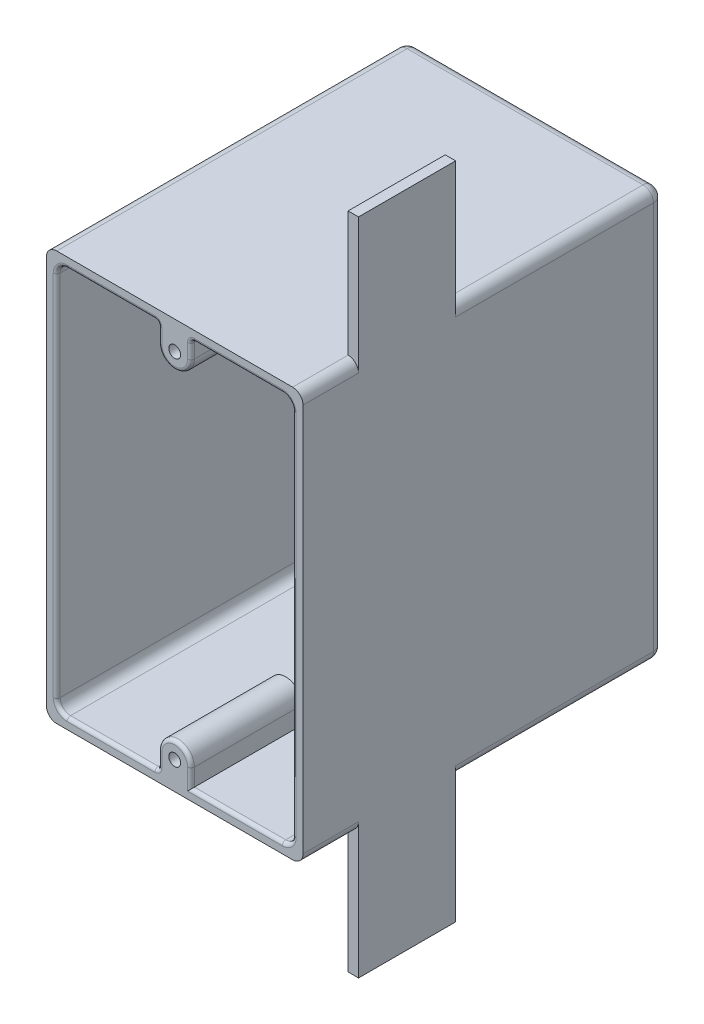
from build123d import *

# Parameters (mm, degrees)
SKETCH1_W           = 58.7375
SKETCH1_H           = 93.6625
BACK_DEPTH          = 2.38125
SKETCH2_W           = 58.7375
SKETCH2_H           = 93.6625
SKETCH2_W_2         = 53.975
SKETCH2_H_2         = 88.9
SIDES_DEPTH         = 80.16875
SKETCH6_R           = 1.35255
BOSS_EXTRUDE6_DEPTH = 25.4
SKETCH5_W           = 22.225
SKETCH5_H           = 28.575
BOSS_EXTRUDE5_DEPTH = 2.38125
FILLET4_R           = 2.38125
FILLET5_R           = 0.79375


with BuildPart() as part:
    # Sketch1 → Back (new body)
    with BuildSketch(Plane.XY):
        Rectangle(SKETCH1_W, SKETCH1_H)
    extrude(amount=BACK_DEPTH)

    # Sketch2 → Sides (add)
    with BuildSketch(Plane.XY.offset(2.38125)):
        Rectangle(SKETCH2_W, SKETCH2_H)
        Rectangle(SKETCH2_W_2, SKETCH2_H_2, mode=Mode.SUBTRACT)
    extrude(amount=SIDES_DEPTH)

    # Sketch6 → Boss-Extrude6 (add)
    # profile 1 of 2: a face of its own
    with BuildSketch(Plane.XY.offset(82.55)):
        with BuildLine():
            Line((-3.7338, 40.379264529), (-3.7338, 44.45))
            Line((-3.7338, 44.45), (3.7338, 44.45))
            Line((3.7338, 44.45), (3.7338, 40.379264529))
            ThreePointArc((3.7338, 40.379264529), (0, 36.645464529), (-3.7338, 40.379264529))
        make_face()
        with Locations((0, 40.379264529)):
            Circle(SKETCH6_R, mode=Mode.SUBTRACT)
    # profile 2 of 2: a face of its own
    with BuildSketch(Plane.XY.offset(82.55)):
        with BuildLine():
            Line((-3.7338, -40.48125), (-3.7338, -44.45))
            Line((-3.7338, -44.45), (3.7338, -44.45))
            Line((3.7338, -44.45), (3.7338, -40.48125))
            ThreePointArc((3.7338, -40.48125), (0, -36.74745), (-3.7338, -40.48125))
        make_face()
        with Locations((0, -40.48125)):
            Circle(SKETCH6_R, mode=Mode.SUBTRACT)
    extrude(amount=-BOSS_EXTRUDE6_DEPTH)

    # Sketch5 → Boss-Extrude5 (add)
    with BuildSketch(Plane(origin=(29.36875, 0, 0), x_dir=(0, 0, -1), z_dir=(1, 0, 0))):
        with Locations((-58.7375, 61.11875)):
            Rectangle(SKETCH5_W, SKETCH5_H)
        with Locations((-58.7375, -61.11875)):
            Rectangle(SKETCH5_W, SKETCH5_H)
    extrude(amount=-BOSS_EXTRUDE5_DEPTH)

    # Fillet4
    fillet4_edges = [part.edges().sort_by_distance(p)[0] for p in [
        (26.9875, 0, 2.38125),
        (0, -44.45, 2.38125),
        (-26.9875, 0, 2.38125),
        (0, 44.45, 2.38125),
        (0, 46.83125, 0),
        (-29.36875, 0, 0),
        (0, -46.83125, 0),
        (29.36875, 0, 0),
        (-26.9875, -44.45, 42.465625),
        (-26.9875, 44.45, 42.465625),
        (26.9875, 44.45, 42.465625),
        (26.9875, -44.45, 42.465625),
        (29.36875, 46.83125, 23.8125),
        (29.36875, -46.83125, 23.8125),
        (29.36875, -46.83125, 76.2),
        (29.36875, 46.83125, 76.2),
        (-29.36875, -46.83125, 41.275),
        (-29.36875, 46.83125, 41.275),
    ]]
    fillet(fillet4_edges, radius=FILLET4_R)

    # Fillet5
    fillet5_edges = [part.edges().sort_by_distance(p)[0] for p in [
        (-26.290048023, -43.752548023, 82.55),
        (-26.290048023, 43.752548023, 82.55),
        (26.290048023, 43.752548023, 82.55),
        (26.290048023, -43.752548023, 82.55),
        (-14.170025, 44.45, 82.55),
        (0, 44.45, 57.15),
        (-3.7338, 44.45, 69.85),
        (3.7338, 44.45, 69.85),
        (0, 36.645464529, 82.55),
        (3.7338, 42.414632265, 82.55),
        (-3.7338, 42.414632265, 82.55),
        (14.170025, -44.45, 82.55),
        (-3.7338, -44.45, 69.85),
        (0, -36.74745, 82.55),
        (-3.7338, -42.465625, 82.55),
        (3.7338, -42.465625, 82.55),
        (26.9875, 0, 82.55),
        (-14.170025, -44.45, 82.55),
        (-26.9875, 0, 82.55),
        (14.170025, 44.45, 82.55),
    ]]
    fillet(fillet5_edges, radius=FILLET5_R)


solid = part.part
